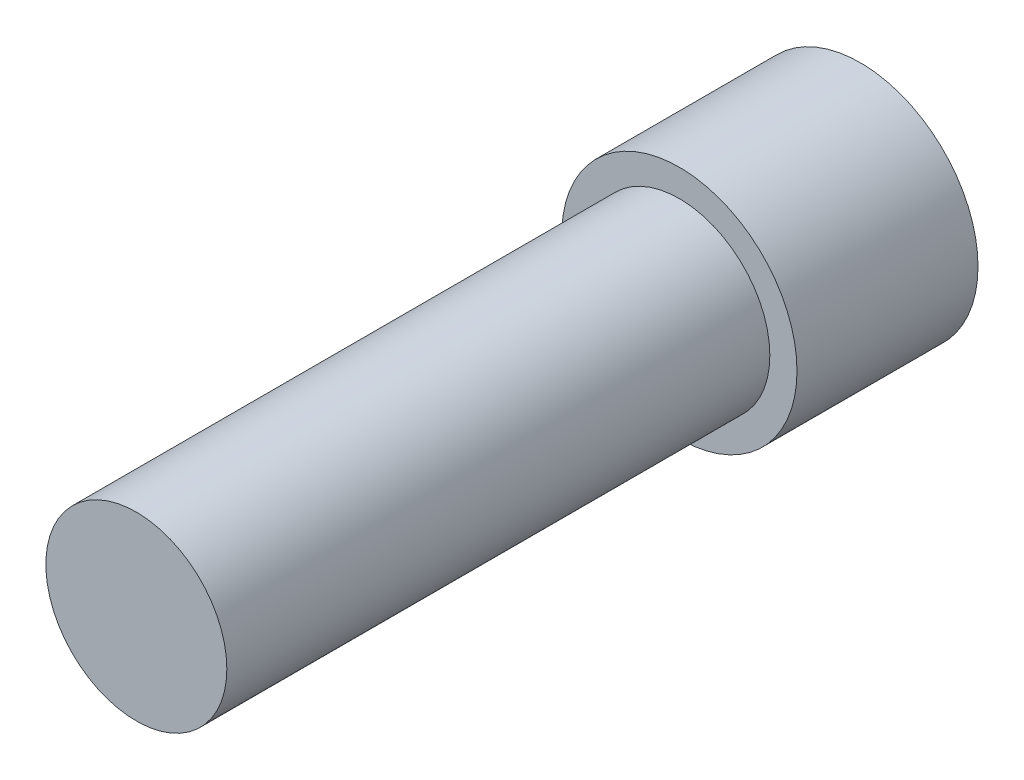
from build123d import *

# Parameters (mm, degrees)
SKETCH1_R           = 6.5
BOSS_EXTRUDE1_DEPTH = 10
SKETCH2_R           = 5
BOSS_EXTRUDE2_DEPTH = 30
CUT_EXTRUDE1_DEPTH  = 5


with BuildPart() as part:
    # Sketch1 → Boss-Extrude1 (new body)
    with BuildSketch(Plane.XY):
        Circle(SKETCH1_R)
    extrude(amount=BOSS_EXTRUDE1_DEPTH)

    # Sketch2 → Boss-Extrude2 (add)
    with BuildSketch(Plane.XY.offset(10)):
        Circle(SKETCH2_R)
    extrude(amount=BOSS_EXTRUDE2_DEPTH)

    # Sketch3 → Cut-Extrude1 (cut)
    with BuildSketch(Plane(origin=(0, 0, 0), x_dir=(-1, 0, 0), z_dir=(0, 0, -1))):
        Polygon((4.5, 2.598076211), (0, 5.196152423), (-4.5, 2.598076211), (-4.5, -2.598076211), (0, -5.196152423), (4.5, -2.598076211), align=None)
    extrude(amount=-CUT_EXTRUDE1_DEPTH, mode=Mode.SUBTRACT)


solid = part.part
